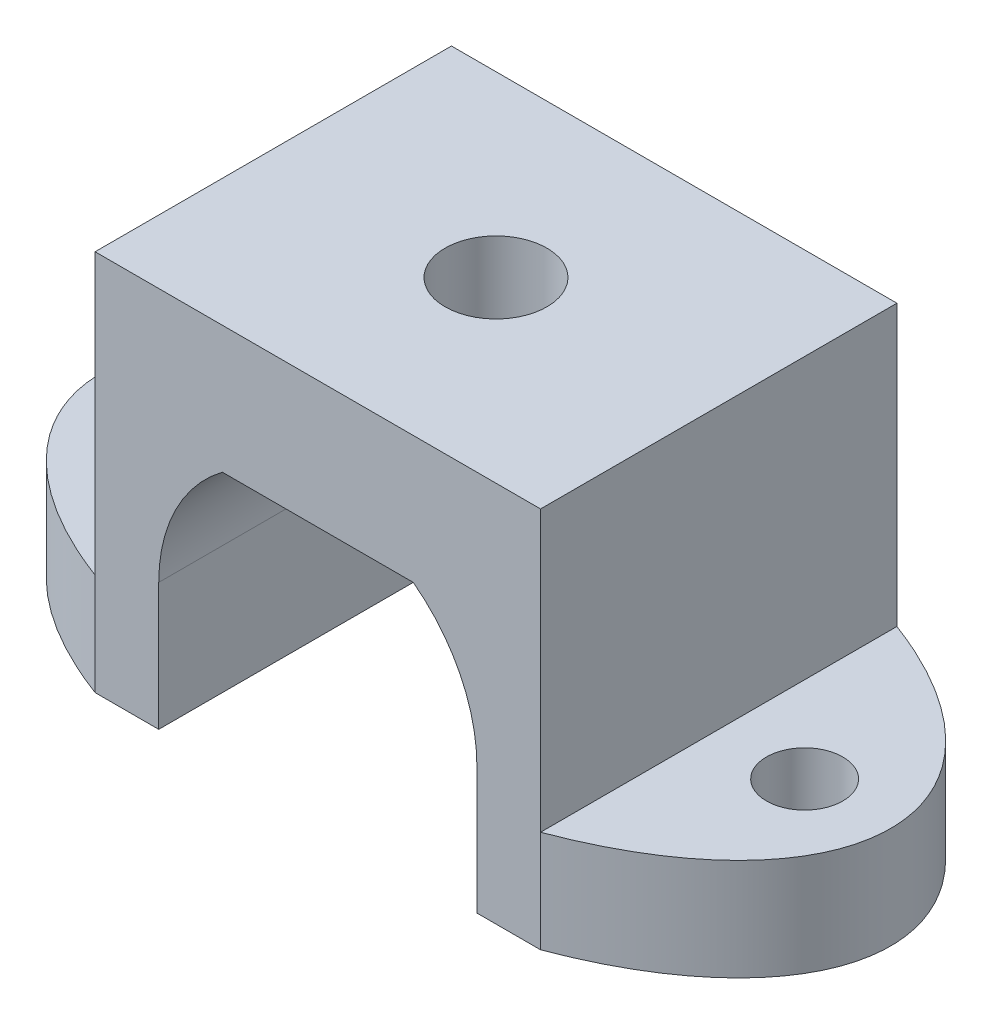
from build123d import *

# Parameters (mm, degrees)
BOSS_EXTRU_1_DEPTH      = 7
ESQUISSE3_R             = 1.5
ENL_V_MAT_EXTRU_2_DEPTH = 8.5
ESQUISSE4_R             = 2
ENL_V_MAT_EXTRU_3_DEPTH = 23.677080941
ENL_V_MAT_EXTRU_4_DEPTH = 21.254629101


with BuildPart() as part:
    # Esquisse1 → Boss.-Extru.1 (new, symmetric)
    with BuildSketch(Plane.XY):
        with BuildLine():
            Line((-15.5, 0), (-6.25, 0))
            Line((-6.25, 0), (-6.25, 5))
            ThreePointArc((-6.25, 5), (-5.590169944, 7.795084972), (-3.75, 10))
            Line((-3.75, 10), (3.75, 10))
            ThreePointArc((3.75, 10), (5.590169944, 7.795084972), (6.25, 5))
            Line((6.25, 5), (6.25, 0))
            Line((6.25, 0), (15.5, 0))
            Line((15.5, 0), (15.5, 4))
            Line((15.5, 4), (8.75, 4))
            Line((8.75, 4), (8.75, 15))
            Line((8.75, 15), (-8.75, 15))
            Line((-8.75, 15), (-8.75, 4))
            Line((-8.75, 4), (-15.5, 4))
            Line((-15.5, 4), (-15.5, 0))
        make_face()
    extrude(amount=BOSS_EXTRU_1_DEPTH, both=True)

    # Esquisse3 → Enlèv. mat.-Extru.2 (cut)
    with BuildSketch(Plane(origin=(0, 4, 0), x_dir=(1, 0, 0), z_dir=(0, 1, 0))):
        with Locations(Location((-12.125, 0, 0), (0, 0, 180))):
            Circle(ESQUISSE3_R)
        with Locations(Location((12.125, 0, 0), (0, 0, 270))):
            Circle(ESQUISSE3_R)
    extrude(amount=-ENL_V_MAT_EXTRU_2_DEPTH, mode=Mode.SUBTRACT)

    # Esquisse4 → Enlèv. mat.-Extru.3 (cut, through all)
    with BuildSketch(Plane(origin=(0, 15, 0), x_dir=(1, 0, 0), z_dir=(0, 1, 0))):
        with Locations(Location((0, 0, 0), (0, 0, 270))):
            Circle(ESQUISSE4_R)
    extrude(amount=-ENL_V_MAT_EXTRU_3_DEPTH, mode=Mode.SUBTRACT)

    # Esquisse5 → Enlèv. mat.-Extru.4 (cut, through all)
    with BuildSketch(Plane(origin=(0, 4, 0), x_dir=(1, 0, 0), z_dir=(0, 1, 0))):
        with BuildLine():
            add(Edge.make_bspline(
                [(-8.75, 7), (-15.499999967, 4.474226816), (-15.5, 3.4e-08)],
                knots=[2.170643252, 2.170643252, 2.170643252, 3.14159265, 3.14159265, 3.14159265], degree=2, weights=[1, 0.884453541, 1]))
            Line((-8.75, 7), (-15.5, 7))
            Line((-15.5, 7), (-15.5, 3.4e-08))
        make_face()
        with BuildLine():
            Line((15.5, 7), (8.75, 7))
            add(Edge.make_bspline(
                [(15.5, 0), (15.5, 4.474226804), (8.75, 7)],
                knots=[0, 0, 0, 0.970949401, 0.970949401, 0.970949401], degree=2, weights=[1, 0.88445354, 1]))
            Line((15.5, 0), (15.5, 7))
        make_face()
        with BuildLine():
            add(Edge.make_bspline(
                [(-15.5, 3.4e-08), (-15.500000033, -4.474226792), (-8.75, -7)],
                knots=[3.14159265, 3.14159265, 3.14159265, 4.112542055, 4.112542055, 4.112542055], degree=2, weights=[1, 0.884453539, 1]))
            Line((-15.5, 3.4e-08), (-15.5, -7))
            Line((-15.5, -7), (-8.75, -7))
        make_face()
        with BuildLine():
            Line((15.5, -7), (15.5, 0))
            add(Edge.make_bspline(
                [(8.75, -7), (15.5, -4.474226804), (15.5, 0)],
                knots=[5.312235906, 5.312235906, 5.312235906, 6.283185307, 6.283185307, 6.283185307], degree=2, weights=[1, 0.88445354, 1]))
            Line((8.75, -7), (15.5, -7))
        make_face()
    extrude(amount=-ENL_V_MAT_EXTRU_4_DEPTH, mode=Mode.SUBTRACT)


solid = part.part
